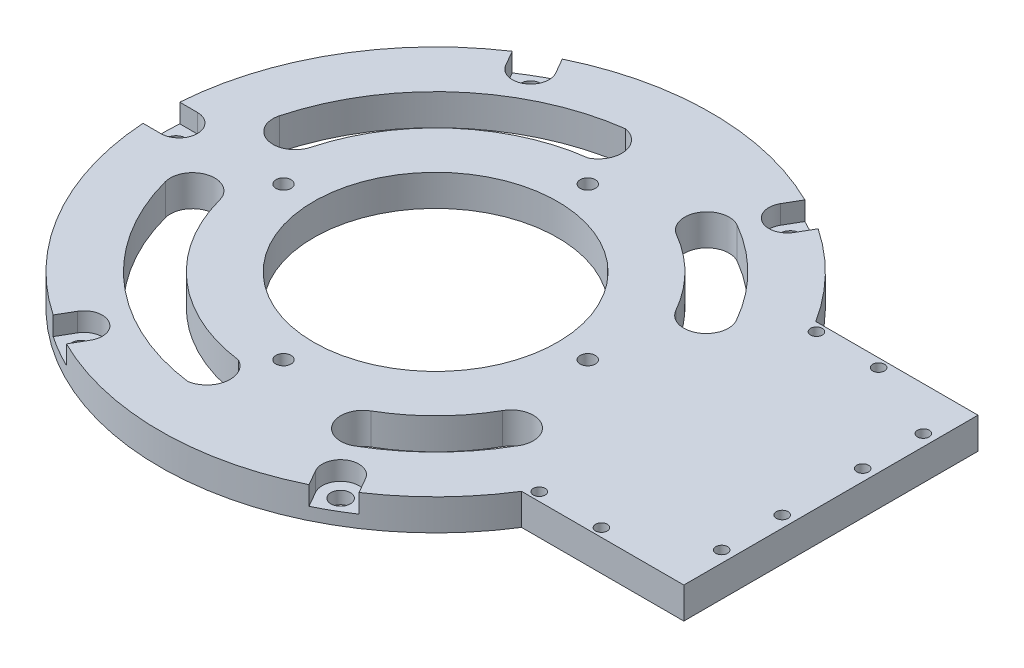
from build123d import *

# Parameters (mm, degrees)
BOSS_EXTRUDE1_DEPTH              = 13
CUT_EXTRUDE1_DEPTH               = 201.804739102
CUT_EXTRUDE2_DEPTH               = 201.804739102
CUT_EXTRUDE3_DEPTH               = 201.804739102
CUT_EXTRUDE4_DEPTH               = 201.804739102
CUT_EXTRUDE5_DEPTH               = 7.8
SKETCH9_W                        = 4.064
SKETCH9_H                        = 5.2
F_1_4_CLEARANCE_HOLE1_AT_2_COUNT = 2
F_1_4_CLEARANCE_HOLE1_AT_2_PITCH = 107.95
F_1_4_CLEARANCE_HOLE1_AT_3_COUNT = 2
F_1_4_CLEARANCE_HOLE1_AT_3_PITCH = 186.974884677
F_1_4_CLEARANCE_HOLE1_AT_4_COUNT = 2
F_1_4_CLEARANCE_HOLE1_AT_4_PITCH = 215.9
F_1_4_CLEARANCE_HOLE1_AT_5_COUNT = 2
F_1_4_CLEARANCE_HOLE1_AT_5_PITCH = 107.95
HOLE1_D                          = 6.3
HOLE2_D                          = 101.44
F_8_CLEARANCE_HOLE1_D            = 4.88
CIRPATTERN2_COUNT                = 6


with BuildPart() as part:
    # Sketch1 → Boss-Extrude1 (new body)
    with BuildSketch(Plane(origin=(0, 0, 0), x_dir=(1, 0, 0), z_dir=(0, 1, 0))):
        with BuildLine():
            Line((164.38099488, 61.17), (96.905432604, 61.17))
            ThreePointArc((96.905432604, 61.17), (-114.596822679, 0), (96.905432604, -61.17))
            Line((96.905432604, -61.17), (164.38099488, -61.17))
            Line((164.38099488, -61.17), (164.38099488, 61.17))
        make_face()
    extrude(amount=-BOSS_EXTRUDE1_DEPTH)

    # Sketch2 → Cut-Extrude1 (cut, through all)
    with BuildSketch(Plane.XZ.offset(13)):
        with BuildLine():
            ThreePointArc((36.664399822, -63.490820086), (33.280235587, -76.125443336), (45.914858837, -79.509607572))
            ThreePointArc((45.914858837, -79.509607572), (65.250493783, -64.593536978), (79.970145175, -45.107957601))
            ThreePointArc((79.970145175, -45.107957601), (76.458305593, -32.508225263), (63.858573255, -36.020064845))
            ThreePointArc((63.858573255, -36.020064845), (52.104487594, -51.579887768), (36.664399822, -63.490820086))
        make_face()
    extrude(amount=-CUT_EXTRUDE1_DEPTH, mode=Mode.SUBTRACT)

    # Sketch3 → Cut-Extrude2 (cut, through all)
    with BuildSketch(Plane.XZ.offset(13)):
        with BuildLine():
            ThreePointArc((45.914858837, 79.509607572), (33.280235587, 76.125443336), (36.664399822, 63.490820086))
            ThreePointArc((36.664399822, 63.490820086), (52.104487594, 51.579887768), (63.858573255, 36.020064845))
            ThreePointArc((63.858573255, 36.020064845), (76.458305593, 32.508225263), (79.970145175, 45.107957601))
            ThreePointArc((79.970145175, 45.107957601), (65.250493783, 64.593536978), (45.914858837, 79.509607572))
        make_face()
    extrude(amount=-CUT_EXTRUDE2_DEPTH, mode=Mode.SUBTRACT)

    # Sketch4 → Cut-Extrude3 (cut, through all)
    with BuildSketch(Plane.XZ.offset(13)):
        with BuildLine():
            ThreePointArc((-12.00973997, -91.025919957), (-4.095291585, -82.854974293), (-9.276109056, -72.727685583))
            ThreePointArc((-9.276109056, -72.727685583), (-48.237079471, -55.213645176), (-70.823685709, -18.957003774))
            ThreePointArc((-70.823685709, -18.957003774), (-82.149557569, -12.413999964), (-88.692561379, -23.739871823))
            ThreePointArc((-88.692561379, -23.739871823), (-60.556514452, -69.01348068), (-12.00973997, -91.025919957))
        make_face()
    extrude(amount=-CUT_EXTRUDE3_DEPTH, mode=Mode.SUBTRACT)

    # Sketch5 → Cut-Extrude4 (cut, through all)
    with BuildSketch(Plane.XZ.offset(13)):
        with BuildLine():
            ThreePointArc((-88.692561379, 23.739871823), (-82.149557569, 12.413999964), (-70.823685709, 18.957003774))
            ThreePointArc((-70.823685709, 18.957003774), (-48.237079471, 55.213645176), (-9.276109056, 72.727685583))
            ThreePointArc((-9.276109056, 72.727685583), (-4.095291585, 82.854974293), (-12.00973997, 91.025919957))
            ThreePointArc((-12.00973997, 91.025919957), (-60.556514452, 69.01348068), (-88.692561379, 23.739871823))
        make_face()
    extrude(amount=-CUT_EXTRUDE4_DEPTH, mode=Mode.SUBTRACT)

    # Sketch6 → Cut-Extrude5 (cut)
    with BuildSketch(Plane(origin=(0, 0, 0), x_dir=(-1, 0, 0), z_dir=(0, 1, 0))):
        with BuildLine():
            Line((114.362561544, 7.323679763), (106.996209034, 7.342768071))
            ThreePointArc((106.996209034, 7.342768071), (99.356489103, -0.257460832), (106.956718006, -7.897180763))
            Line((106.956718006, -7.897180763), (114.323070516, -7.91626907))
            ThreePointArc((114.323070516, -7.91626907), (114.596437937, -0.29695186), (114.362561544, 7.323679763))
        make_face()
    cut_extrude5 = extrude(amount=-CUT_EXTRUDE5_DEPTH, mode=Mode.SUBTRACT)

    # Sketch9 → 1/4 Clearance Hole1 (revolve, cut)
    with BuildSketch(Plane(origin=(-53.975, -7.8, 93.487442339), x_dir=(0, 0, 1), z_dir=(1, 0, 0))):
        with Locations((2.032, 2.6)):
            Rectangle(SKETCH9_W, SKETCH9_H)
    f_1_4_clearance_hole1 = revolve(axis=Axis((-53.975, -1.45, 93.487442339), (0, -1, 0)), mode=Mode.SUBTRACT)

    # 1/4 Clearance Hole1 at 2: 1/4 Clearance Hole1 ×2
    with Locations(*[Vector(-0.499999999999995, 0, -0.8660254037844416) * (i * F_1_4_CLEARANCE_HOLE1_AT_2_PITCH) for i in range(1, F_1_4_CLEARANCE_HOLE1_AT_2_COUNT)]):
        add(f_1_4_clearance_hole1, mode=Mode.SUBTRACT)

    # 1/4 Clearance Hole1 at 3: 1/4 Clearance Hole1 ×2
    with Locations(*[(0, 0, -i * F_1_4_CLEARANCE_HOLE1_AT_3_PITCH) for i in range(1, F_1_4_CLEARANCE_HOLE1_AT_3_COUNT)]):
        add(f_1_4_clearance_hole1, mode=Mode.SUBTRACT)

    # 1/4 Clearance Hole1 at 4: 1/4 Clearance Hole1 ×2
    with Locations(*[Vector(0.5000000000000071, 0, -0.8660254037844346) * (i * F_1_4_CLEARANCE_HOLE1_AT_4_PITCH) for i in range(1, F_1_4_CLEARANCE_HOLE1_AT_4_COUNT)]):
        add(f_1_4_clearance_hole1, mode=Mode.SUBTRACT)

    # 1/4 Clearance Hole1 at 5: 1/4 Clearance Hole1 ×2
    with Locations(*[(i * F_1_4_CLEARANCE_HOLE1_AT_5_PITCH, 0, 0) for i in range(1, F_1_4_CLEARANCE_HOLE1_AT_5_COUNT)]):
        add(f_1_4_clearance_hole1, mode=Mode.SUBTRACT)

    # Hole1 (through all)
    with Locations(Plane(origin=(0, 0, 0), x_dir=(1, 0, 0), z_dir=(0, 1, 0))):
        with Locations((63.27, 0), (0, -63.27), (-63.27, 0), (0, 63.27)):
            Hole(HOLE1_D / 2)

    # Hole2 (through all)
    with Locations(Plane(origin=(0, 0, 0), x_dir=(1, 0, 0), z_dir=(0, 1, 0))):
        with Locations((0, 0)):
            Hole(HOLE2_D / 2)

    # #8 Clearance Hole1 (through all)
    with Locations(Plane(origin=(0, -13, 0), x_dir=(-1, 0, 0), z_dir=(0, -1, 0))):
        with Locations((-159.64099488, -40.668301559), (-159.64099488, 17.964494153), (-126.578871671, 57.63), (-126.578871671, -57.63), (-159.64099488, 43.162614752), (-159.64099488, -15.500531602), (-100.720889468, 57.63), (-100.720889468, -57.63)):
            Hole(F_8_CLEARANCE_HOLE1_D / 2)

    # CirPattern2: Cut-Extrude5 ×6 about axis, 1 skipped
    cirpattern2_axis = Axis((0, 0, 0), (0, 1, 0))
    add([cut_extrude5.rotate(cirpattern2_axis, i * 360 / CIRPATTERN2_COUNT) for i in range(1, CIRPATTERN2_COUNT) if i not in (3,)], mode=Mode.SUBTRACT)


solid = part.part
